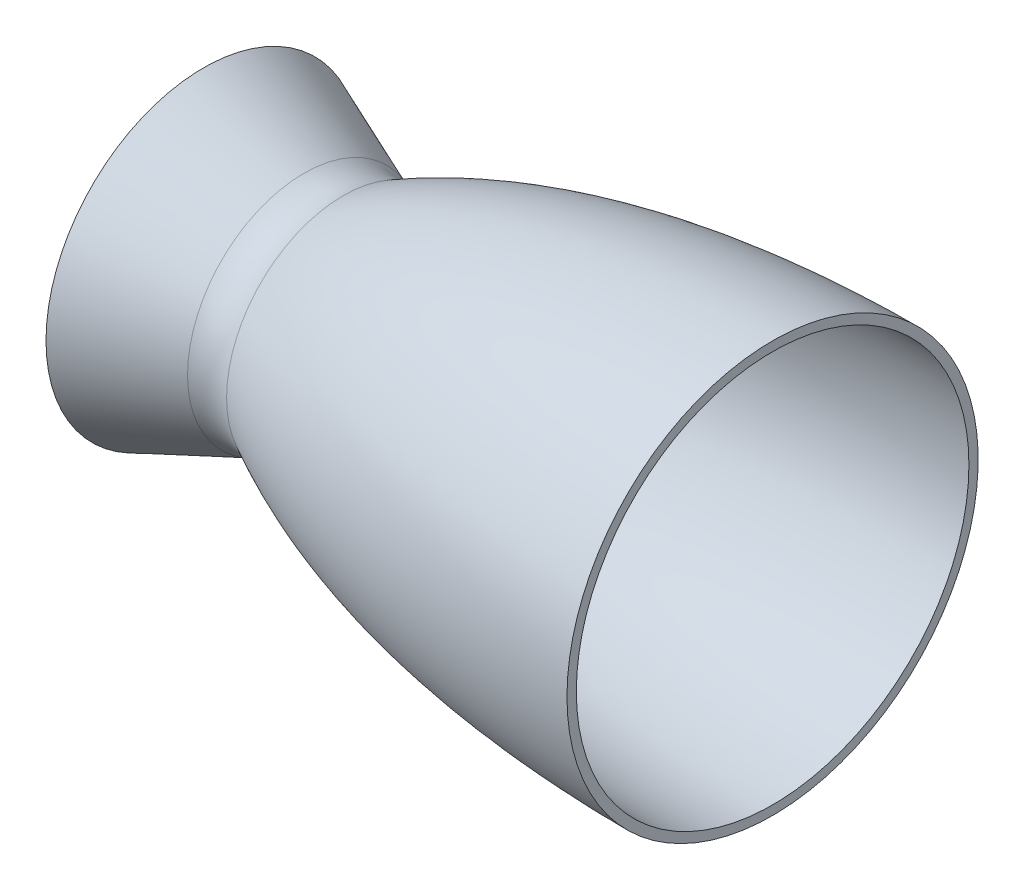
from build123d import *


with BuildPart() as part:
    # Sketch1 → Revolve1 (revolve)
    with BuildSketch(Plane.XY, mode=Mode.PRIVATE) as revolve1_sk:
        with BuildLine():
            Line((-14.07542386, 37.568273806), (-46.470976776, 50.816977564))
            Line((-46.470976776, 50.816977564), (-47.606579955, 48.040215886))
            Line((-47.606579955, 48.040215886), (-15.211027039, 34.791512127))
            ThreePointArc((-15.211027039, 34.791512127), (-7.582403195, 33.20965431), (0, 35))
            add(Edge.make_bspline(
                [(0, 35), (0.554982885, 35.292078076), (1.529548525, 35.804975437), (2.937168515, 36.528646974), (4.670505008, 37.403247331), (6.441777952, 38.270978901), (8.72353094, 39.355824676), (10.60527745, 40.222883125), (13.032290671, 41.306133357), (15.036209453, 42.17114709), (17.087094086, 43.02680226), (18.673403682, 43.673231436), (20.856984777, 44.541896716), (23.094257988, 45.39904617), (25.989126484, 46.46638141), (28.386871241, 47.315207138), (30.84541355, 48.150088409), (32.753517217, 48.779526201), (34.708527913, 49.405481958), (36.712155185, 50.027535636), (39.482315388, 50.860724256), (42.327286953, 51.67455728), (45.249208852, 52.468327667), (47.52394585, 53.064185949), (50.676189667, 53.859346127), (53.917505014, 54.629238229), (57.250572852, 55.37298295), (59.851417574, 55.928080058), (62.525243047, 56.472822795), (65.274940322, 57.00632226), (69.098543953, 57.711093835), (74.092224808, 58.5579122), (79.241968973, 59.331198352), (83.546726971, 59.915803354), (88.114361176, 60.491749339), (92.827871443, 61.016524652), (97.692576244, 61.488322173), (101.514881987, 61.821919317), (105.461815144, 62.128127777), (109.539052294, 62.404835389), (113.752598134, 62.649957567), (118.108825402, 62.86101428), (122.614486305, 63.035832281), (127.276766252, 63.170626485), (132.103271493, 63.266601223), (135.376710135, 63.291555158), (137.04201, 63.30425)],
                knots=[0, 0, 0, 0, 0.013316339, 0.023383869, 0.033606485, 0.054540129, 0.065262967, 0.087252117, 0.09853175, 0.12169581, 0.133595111, 0.145716248, 0.158067223, 0.18349317, 0.196585983, 0.223578759, 0.23749902, 0.251715999, 0.266240967, 0.281085577, 0.296262138, 0.327662633, 0.343913879, 0.360551775, 0.377591616, 0.412941995, 0.43128705, 0.450103019, 0.469409391, 0.489226518, 0.509575972, 0.551963387, 0.596767231, 0.620142346, 0.644205069, 0.694519486, 0.720838909, 0.747981665, 0.775986766, 0.804895701, 0.834752506, 0.865603944, 0.897499706, 0.930492752, 0.964639505, 1, 1, 1, 1], degree=3))
            Line((137.04201, 63.30425), (137.019141195, 66.304162835))
            add(Edge.make_bspline(
                [(-1.3971712, 37.654790507), (-0.745970647, 37.99750631), (-0.086364061, 38.34452892), (1.243299523, 39.031913103), (1.909234943, 39.371004332), (3.913812499, 40.377229123), (5.257968525, 41.032169281), (9.31154575, 42.949933492), (12.042210127, 44.165642688), (20.305949906, 47.631351256), (25.910290073, 49.699677139), (37.249046848, 53.398748809), (42.983668181, 55.029852707), (54.5380921, 57.905889985), (60.358000499, 59.150914609), (72.050774464, 61.303130557), (77.923763431, 62.210360725), (89.700224637, 63.729913919), (95.603725032, 64.342241655), (107.425404783, 65.309182419), (113.343652658, 65.663660588), (122.224200636, 66.026144413), (125.184186024, 66.11797589), (129.625148543, 66.218034256), (131.108100806, 66.244680865), (134.070837435, 66.281699318), (135.547424791, 66.29294371), (137.019141195, 66.304162835)],
                knots=[0, 0, 0, 0, 0.015625, 0.015625, 0.03125, 0.03125, 0.0625, 0.0625, 0.125, 0.125, 0.25, 0.25, 0.375, 0.375, 0.5, 0.5, 0.625, 0.625, 0.75, 0.75, 0.875, 0.875, 0.9375, 0.9375, 0.96875, 0.96875, 1, 1, 1, 1], degree=3))
            ThreePointArc((-1.3971712, 37.654790507), (-7.726707385, 36.206181683), (-14.07542386, 37.568273806))
        make_face()
    revolve(revolve1_sk.sketch.rotate(Axis((-87.932781481, 0, 0), (1, 0, 0)), 90), axis=Axis((-87.932781481, 0, 0), (1, 0, 0)))


solid = part.part
